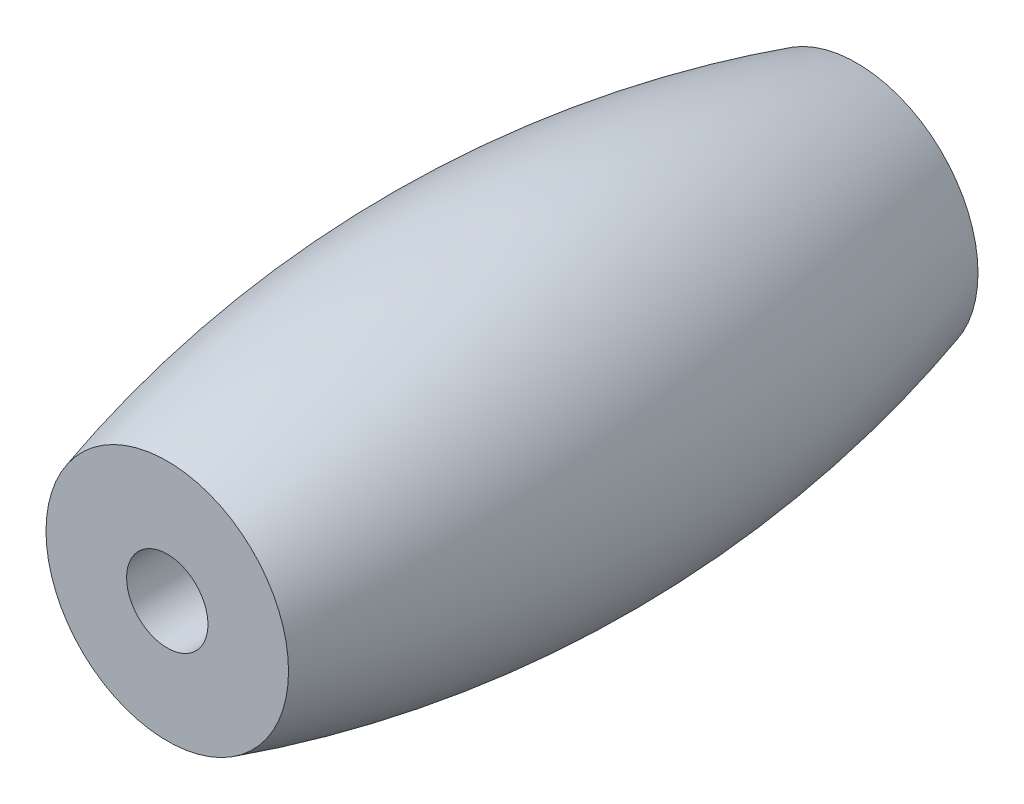
from build123d import *

# Parameters (mm, degrees)
SKETCH2_R          = 1.05
CUT_EXTRUDE1_DEPTH = 36.014695635


with BuildPart() as part:
    # Sketch1 → Revolve1 (revolve)
    with BuildSketch(Plane(origin=(0, 0, 0), x_dir=(0, 0, -1), z_dir=(1, 0, 0)), mode=Mode.PRIVATE) as revolve1_sk:
        with BuildLine():
            Line((-8.5, 25.43), (8.9, 25.43))
            Line((8.9, 25.43), (8.9, 28.560413937))
            ThreePointArc((8.9, 28.560413937), (8.700185615, 28.617897875), (8.5, 28.674075373))
            ThreePointArc((8.5, 28.674075373), (0, 29.83), (-8.5, 28.674075373))
            ThreePointArc((-8.5, 28.674075373), (-8.700185615, 28.617897875), (-8.9, 28.560413937))
            Line((-8.9, 28.560413937), (-8.9, 25.43))
            Line((-8.9, 25.43), (-8.5, 25.43))
        make_face()
    revolve(revolve1_sk.sketch.rotate(Axis((0, 25.43, 0), (0, 0, -1)), 90), axis=Axis((0, 25.43, 0), (0, 0, -1)))

    # Sketch2 → Cut-Extrude1 (cut, through all)
    with BuildSketch(Plane(origin=(0, 0, -8.9), x_dir=(-1, 0, 0), z_dir=(0, 0, -1))):
        with Locations((0, 25.43)):
            Circle(SKETCH2_R)
    extrude(amount=-CUT_EXTRUDE1_DEPTH, mode=Mode.SUBTRACT)


solid = part.part
